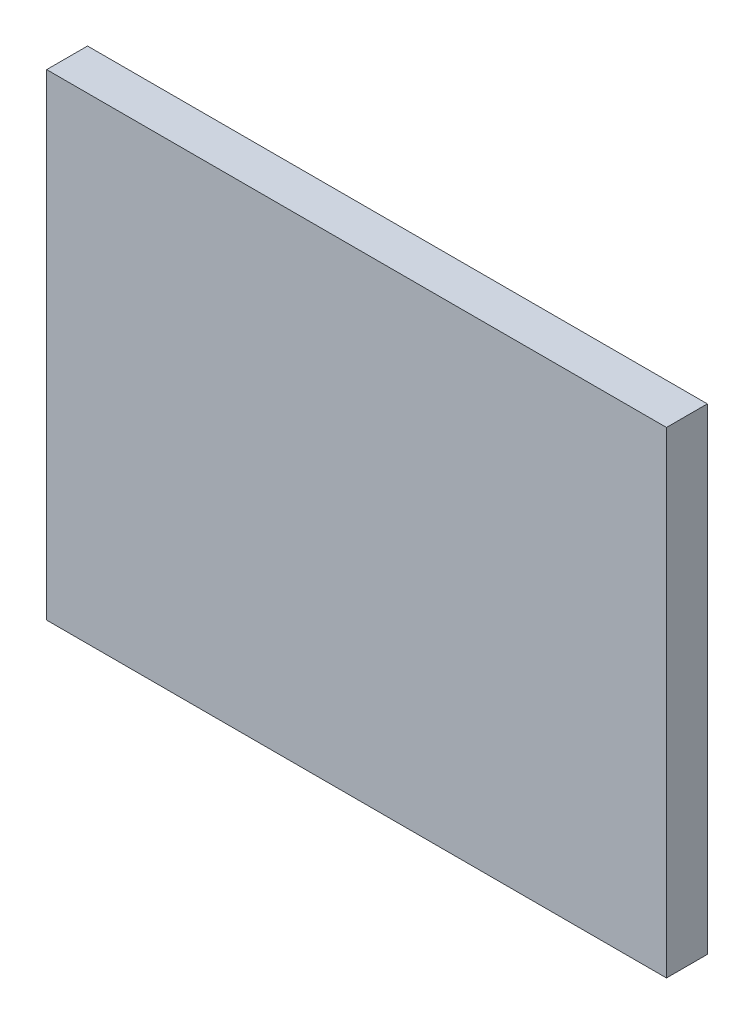
from build123d import *

# Parameters (mm, degrees)
SKETCH1_W           = 91
SKETCH1_H           = 6
BOSS_EXTRUDE1_DEPTH = 70


with BuildPart() as part:
    # Sketch1 → Boss-Extrude1 (new body)
    with BuildSketch(Plane(origin=(0, 0, 0), x_dir=(1, 0, 0), z_dir=(0, 1, 0))):
        Rectangle(SKETCH1_W, SKETCH1_H)
    extrude(amount=BOSS_EXTRUDE1_DEPTH)


solid = part.part
